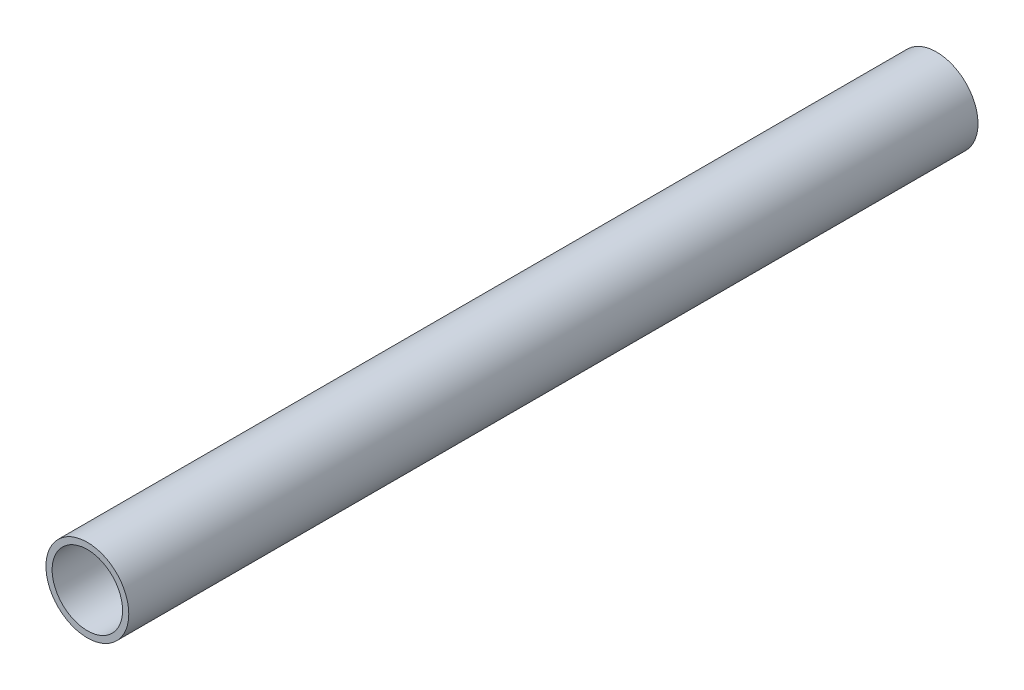
from build123d import *

# Parameters (mm, degrees)
SKETCH1_R           = 20
BOSS_EXTRUDE1_DEPTH = 410
SKETCH2_R           = 17
CUT_EXTRUDE1_DEPTH  = 411.974451761


with BuildPart() as part:
    # Sketch1 → Boss-Extrude1 (new body)
    with BuildSketch(Plane.XY):
        Circle(SKETCH1_R)
    extrude(amount=-BOSS_EXTRUDE1_DEPTH)

    # Sketch2 → Cut-Extrude1 (cut, through all)
    with BuildSketch(Plane.XY):
        Circle(SKETCH2_R)
    extrude(amount=-CUT_EXTRUDE1_DEPTH, mode=Mode.SUBTRACT)


solid = part.part
